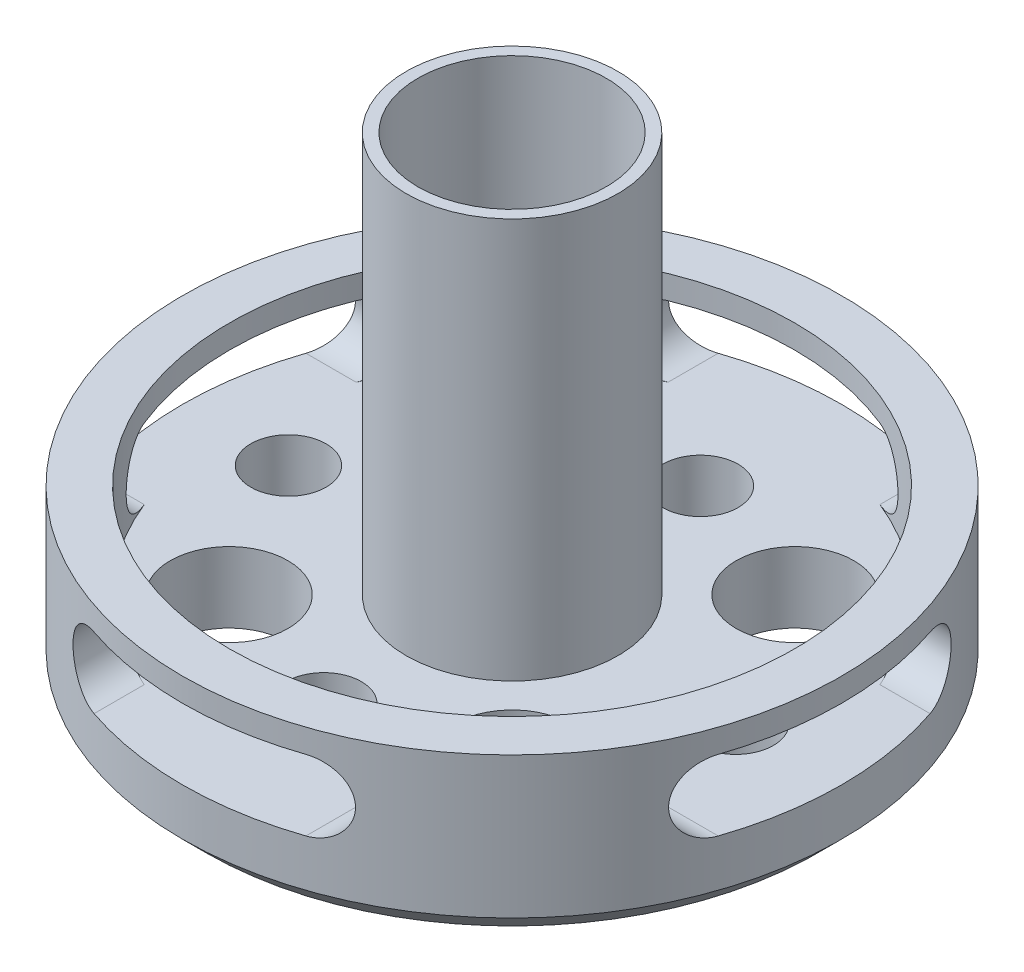
from build123d import *
from build123d.topology import SkipClean

# Parameters (mm, degrees)
SKETCH1_R            = 14
BOSS_EXTRUDE1_DEPTH  = 7
CHAMFER1_SIZE        = 1
SKETCH11_R           = 12
CUT_EXTRUDE3_DEPTH   = 4
M3_CLEARANCE_HOLE2_D = 3.2
SKETCH2_R            = 4
SKETCH2_R_2          = 2.5
CUT_EXTRUDE4_DEPTH   = 3
CHAMFER2_SIZE        = 0.5
CUT_EXTRUDE2_DEPTH   = 14
CIRPATTERN1_COUNT    = 4
SKETCH12_R           = 4.5
SKETCH12_R_2         = 4
BOSS_EXTRUDE3_DEPTH  = 17


with BuildPart() as part:
    # Sketch1 → Boss-Extrude1 (new body)
    with BuildSketch(Plane(origin=(0, 0, 0), x_dir=(1, 0, 0), z_dir=(0, 1, 0))):
        with Locations(Location((0, 0, 0), (0, 0, 270))):
            Circle(SKETCH1_R)
    extrude(amount=BOSS_EXTRUDE1_DEPTH)

    # Chamfer1
    chamfer1_edges = [part.edges().sort_by_distance(p)[0] for p in [
        (0, 0, -14),
    ]]
    chamfer(chamfer1_edges, length=CHAMFER1_SIZE)

    # Sketch11 → Cut-Extrude3 (cut)
    with BuildSketch(Plane(origin=(0, 7, 0), x_dir=(1, 0, 0), z_dir=(0, 1, 0))):
        with Locations(Location((0, 0, 0), (0, 0, 270))):
            Circle(SKETCH11_R)
    extrude(amount=-CUT_EXTRUDE3_DEPTH, mode=Mode.SUBTRACT)

    # M3 Clearance Hole2 (through all)
    with Locations(Plane(origin=(0, 0, 0), x_dir=(-1, 0, 0), z_dir=(0, -1, 0))):
        with Locations((9.5, 0), (-9.5, 0), (0, 8), (0, -8)):
            Hole(M3_CLEARANCE_HOLE2_D / 2)

    # Sketch2 → Cut-Extrude4 (cut)
    with BuildSketch(Plane.XZ):
        with Locations(Location((0, 0, 0), (0, 0, 270))):
            Circle(SKETCH2_R)
        with Locations(Location((6.01040764, 6.01040764, 0), (0, 0, 270))):
            Circle(SKETCH2_R_2)
        with Locations(Location((6.01040764, -6.01040764, 0), (0, 0, 270))):
            Circle(SKETCH2_R_2)
        with Locations(Location((-6.01040764, -6.01040764, 0), (0, 0, 270))):
            Circle(SKETCH2_R_2)
        with Locations(Location((-6.01040764, 6.01040764, 0), (0, 0, 270))):
            Circle(SKETCH2_R_2)
    extrude(amount=-CUT_EXTRUDE4_DEPTH, mode=Mode.SUBTRACT)

    # Chamfer2
    chamfer2_edges = [part.edges().sort_by_distance(p)[0] for p in [
        (0, 0, 4),
    ]]
    chamfer(chamfer2_edges, length=CHAMFER2_SIZE)

    # Sketch10 → Cut-Extrude2 (cut)
    with BuildSketch(Plane(origin=(0, 0, 0), x_dir=(0, 0, -1), z_dir=(1, 0, 0))):
        with BuildLine():
            Line((-4.5, 6), (4.5, 6))
            ThreePointArc((4.5, 6), (6, 4.5), (4.5, 3))
            Line((4.5, 3), (-4.5, 3))
            ThreePointArc((-4.5, 3), (-6, 4.5), (-4.5, 6))
        make_face()
    cut_extrude2 = extrude(amount=-CUT_EXTRUDE2_DEPTH, mode=Mode.SUBTRACT)

    # CirPattern1: Cut-Extrude2 ×4 about axis
    cirpattern1_axis = Axis((0, 3, 0), (0, 1, 0))
    for i in range(1, CIRPATTERN1_COUNT):
        add(cut_extrude2.rotate(cirpattern1_axis, i * 360 / CIRPATTERN1_COUNT), mode=Mode.SUBTRACT)

    # Sketch12 → Boss-Extrude3 (add)
    with SkipClean():  # the faces are left unmerged after this step: merging them gives an invalid solid
        with BuildSketch(Plane(origin=(0, 3, 0), x_dir=(1, 0, 0), z_dir=(0, 1, 0))):
            with Locations(Location((0, 0, 0), (0, 0, 270))):
                Circle(SKETCH12_R)
            with Locations(Location((0, 0, 0), (0, 0, 270))):
                Circle(SKETCH12_R_2, mode=Mode.SUBTRACT)
        extrude(amount=BOSS_EXTRUDE3_DEPTH)


solid = part.part
